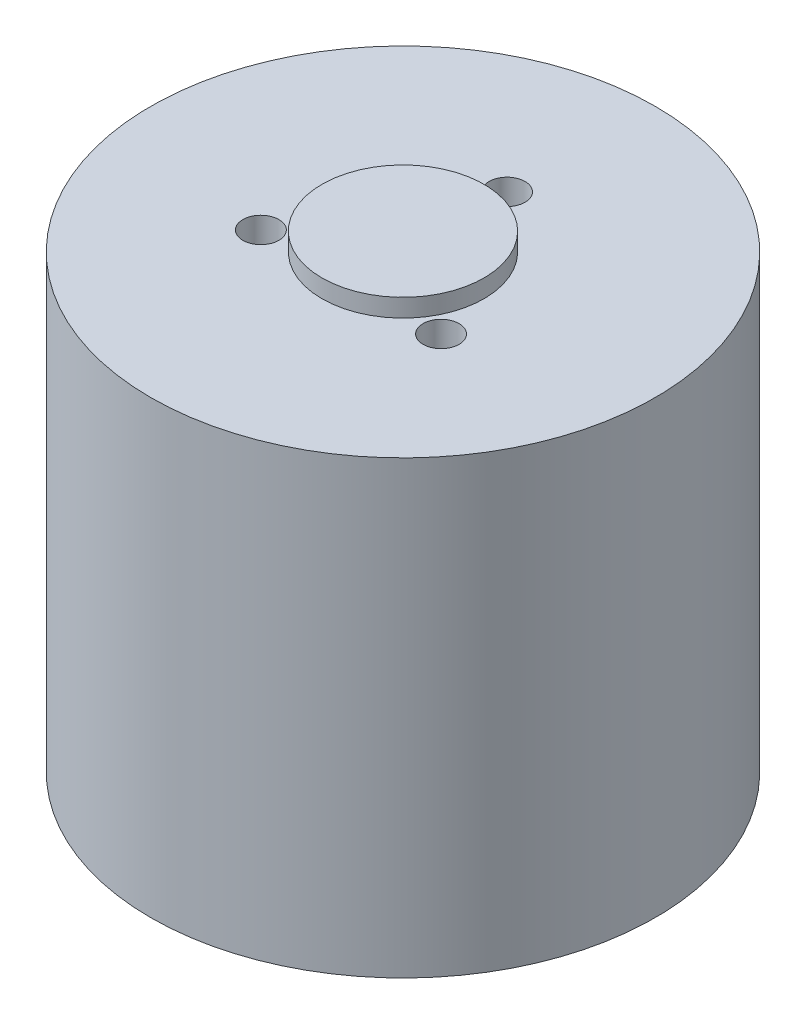
from build123d import *

# Parameters (mm, degrees)
SKETCH1_R           = 14
BOSS_EXTRUDE1_DEPTH = 25
SKETCH3_R           = 4.5
BOSS_EXTRUDE2_DEPTH = 1
SKETCH4_R           = 1
CUT_EXTRUDE1_DEPTH  = 4
SKETCH5_R           = 1.5
CUT_EXTRUDE2_DEPTH  = 4


with BuildPart() as part:
    # Sketch1 → Boss-Extrude1 (new body)
    with BuildSketch(Plane(origin=(0, 0, 0), x_dir=(1, 0, 0), z_dir=(0, 1, 0))):
        Circle(SKETCH1_R)
    extrude(amount=BOSS_EXTRUDE1_DEPTH)

    # Sketch3 → Boss-Extrude2 (add)
    with BuildSketch(Plane(origin=(0, 25, 0), x_dir=(1, 0, 0), z_dir=(0, 1, 0))):
        Circle(SKETCH3_R)
    extrude(amount=BOSS_EXTRUDE2_DEPTH)

    # Sketch4 → Cut-Extrude1 (cut)
    with BuildSketch(Plane(origin=(0, 25, 0), x_dir=(1, 0, 0), z_dir=(0, 1, 0))):
        with Locations((0, 5.773502692)):
            Circle(SKETCH4_R)
        with Locations((5, -2.886751346)):
            Circle(SKETCH4_R)
        with Locations((-5, -2.886751346)):
            Circle(SKETCH4_R)
    extrude(amount=-CUT_EXTRUDE1_DEPTH, mode=Mode.SUBTRACT)

    # Sketch5 → Cut-Extrude2 (cut)
    with BuildSketch(Plane.XZ):
        with Locations((9.5, 0)):
            Circle(SKETCH5_R)
        with Locations((-9.5, 0)):
            Circle(SKETCH5_R)
        with Locations((0, -8)):
            Circle(SKETCH5_R)
        with Locations((0, 8)):
            Circle(SKETCH5_R)
    extrude(amount=-CUT_EXTRUDE2_DEPTH, mode=Mode.SUBTRACT)


solid = part.part
